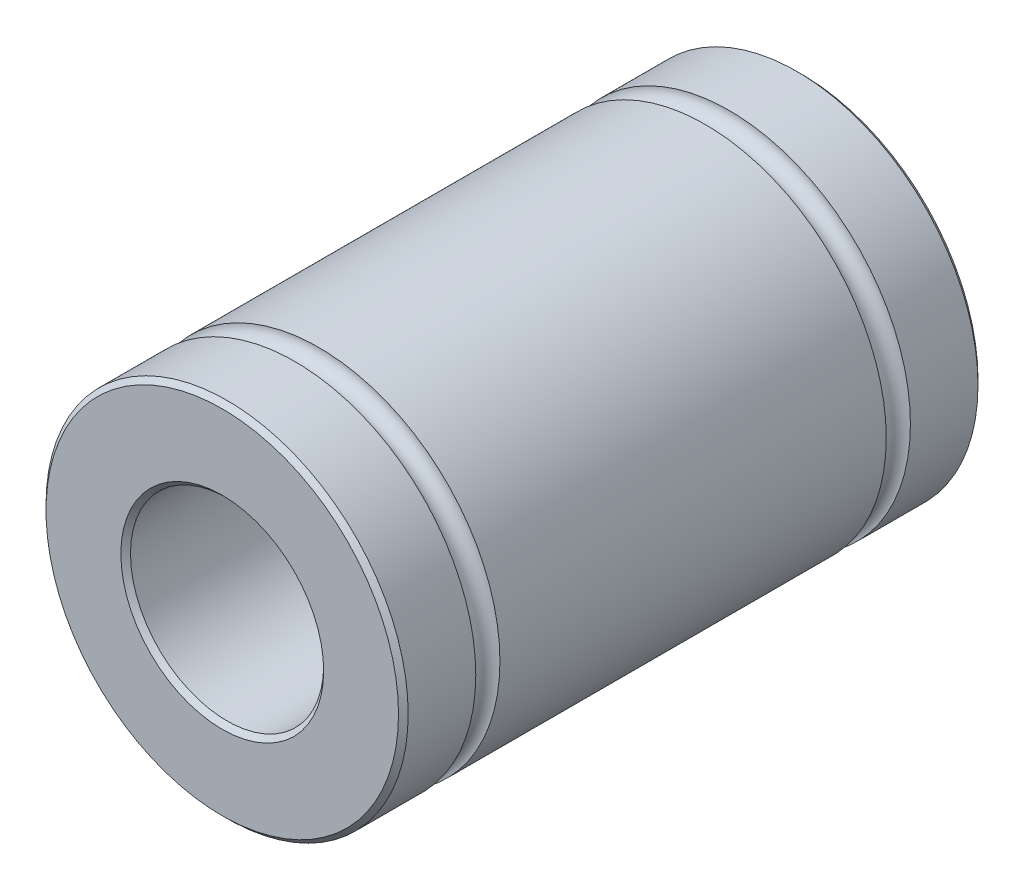
from build123d import *

# Parameters (mm, degrees)
ESQUISSE1_R        = 7.5
ESQUISSE1_R_2      = 4
BOSS_EXTRU_1_DEPTH = 12
CHANFREIN1_SIZE    = 0.2


with BuildPart() as part:
    # Esquisse1 → Boss.-Extru.1 (new, symmetric)
    with BuildSketch(Plane.XY):
        Circle(ESQUISSE1_R)
        Circle(ESQUISSE1_R_2, mode=Mode.SUBTRACT)
    extrude(amount=BOSS_EXTRU_1_DEPTH, both=True)

    # Chanfrein1
    chanfrein1_edges = [part.edges().sort_by_distance(p)[0] for p in [
        (-7.5, 0, -12),
        (-7.5, 0, 12),
        (-4, 0, -12),
        (-4, 0, 12),
    ]]
    chamfer(chanfrein1_edges, length=CHANFREIN1_SIZE)

    # Esquisse2 → Enlèvement de matière-Révolution1 (revolve, cut)
    with BuildSketch(Plane(origin=(0, 0, 0), x_dir=(0, 0, -1), z_dir=(1, 0, 0)), mode=Mode.PRIVATE) as enl_vement_de_mati_re_r_volution1_sk:
        with BuildLine():
            Line((-9, 7.5), (-8, 7.5))
            ThreePointArc((-8, 7.5), (-8.5, 7), (-9, 7.5))
        make_face()
    enl_vement_de_mati_re_r_volution1 = revolve(enl_vement_de_mati_re_r_volution1_sk.sketch.rotate(Axis((0, 0, 55), (0, 0, -1)), 90), axis=Axis((0, 0, 55), (0, 0, -1)), mode=Mode.SUBTRACT)

    # Symétrie1: Enlèvement de matière-Révolution1 across plane
    add(enl_vement_de_mati_re_r_volution1.mirror(Plane.XY), mode=Mode.SUBTRACT)


solid = part.part
